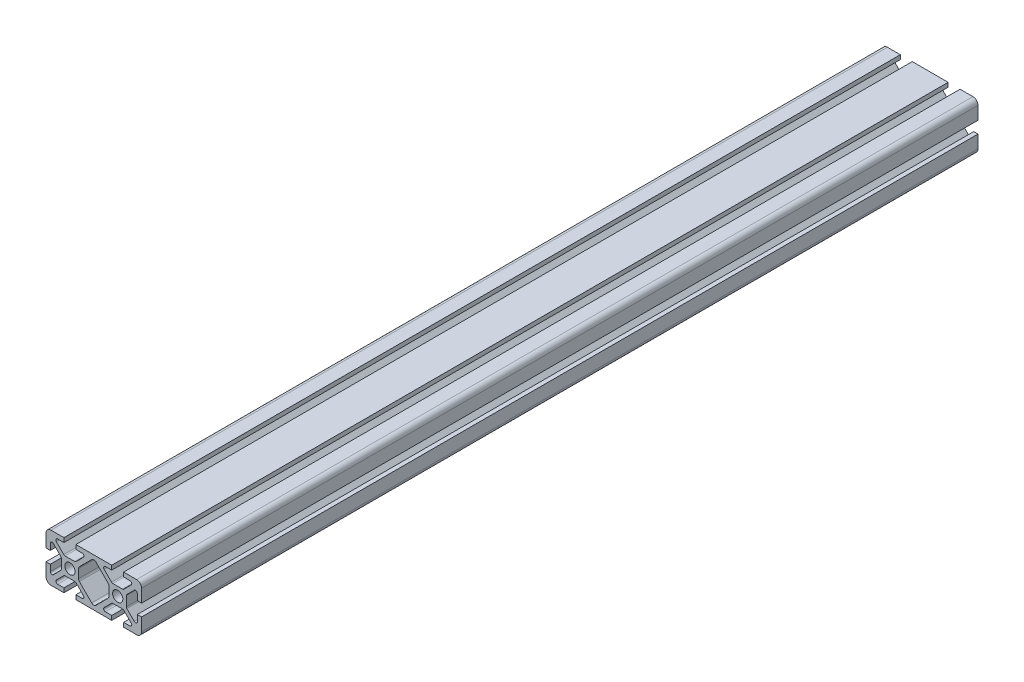
from build123d import *

# Parameters (mm, degrees)
BOSS_EXTRUDE1_DEPTH = 175
BOSS_EXTRUDE2_DEPTH = 175
FILLET1_R           = 0.75
FILLET2_R           = 1.25


with BuildPart() as part:
    # Sketch3 → Boss-Extrude1 (new, symmetric)
    with BuildSketch(Plane.XY):
        with BuildLine():
            Line((12.5, -10), (17.9, -10))
            ThreePointArc((17.9, -10), (19.38492424, -9.38492424), (20, -7.9))
            Line((20, -7.9), (20, -2.5))
            Line((20, -2.5), (18.213351365, -2.5))
            Line((18.213351365, -2.5), (18.213351365, -6.95))
            Line((18.213351365, -6.95), (13.6, -2.336648635))
            Line((13.6, -2.336648635), (13.6, 0))
            Line((13.6, 0), (12.15, 0))
            ThreePointArc((12.15, 0), (11.52027958, -1.52027958), (10, -2.15))
            Line((10, -2.15), (10, -3.6))
            Line((10, -3.6), (12.336648635, -3.6))
            Line((12.336648635, -3.6), (16.95, -8.213351365))
            Line((16.95, -8.213351365), (12.5, -8.213351365))
            Line((12.5, -8.213351365), (12.5, -10))
        make_face()
    extrude(amount=BOSS_EXTRUDE1_DEPTH, both=True)

    # Sketch4 → Boss-Extrude2 (add, symmetric)
    with BuildSketch(Plane.XY):
        with BuildLine():
            Line((10, -3.6), (7.663351365, -3.6))
            Line((7.663351365, -3.6), (3.05, -8.213351365))
            Line((3.05, -8.213351365), (7.5, -8.213351365))
            Line((7.5, -8.213351365), (7.5, -10))
            Line((7.5, -10), (0, -10))
            Line((0, -10), (0, -8.736648635))
            Line((0, -8.736648635), (6.4, -2.336648635))
            Line((6.4, -2.336648635), (6.4, 0))
            Line((6.4, 0), (7.85, 0))
            ThreePointArc((7.85, 0), (8.47972042, -1.52027958), (10, -2.15))
            Line((10, -2.15), (10, -3.6))
        make_face()
    extrude(amount=BOSS_EXTRUDE2_DEPTH, both=True)

    # Mirror1: part across plane


with BuildPart() as part_1:
    add(part.part)
    add(part.part.mirror(Plane(origin=(0, 0, 0), x_dir=(0, 0, 1), z_dir=(1, 0, 0))))

    # Mirror2: part across plane


with BuildPart() as part_2:
    add(part_1.part)
    add(part_1.part.mirror(Plane.ZX))

    # Fillet1
    fillet1_edges = [part_2.edges().sort_by_distance(p)[0] for p in [
        (18.213351365, 6.95, 0),
        (13.6, 2.336648635, 0),
        (12.336648635, 3.6, 0),
        (16.95, 8.213351365, 0),
        (3.05, 8.213351365, 0),
        (7.663351365, 3.6, 0),
        (-18.213351365, 6.95, 0),
        (-13.6, 2.336648635, 0),
        (-7.663351365, 3.6, 0),
        (-12.336648635, 3.6, 0),
        (-16.95, 8.213351365, 0),
        (-3.05, 8.213351365, 0),
        (16.95, -8.213351365, 0),
        (12.336648635, -3.6, 0),
        (13.6, -2.336648635, 0),
        (18.213351365, -6.95, 0),
        (3.05, -8.213351365, 0),
        (7.663351365, -3.6, 0),
        (-18.213351365, -6.95, 0),
        (-13.6, -2.336648635, 0),
        (-12.336648635, -3.6, 0),
        (-16.95, -8.213351365, 0),
        (-3.05, -8.213351365, 0),
        (-7.663351365, -3.6, 0),
    ]]
    fillet(fillet1_edges, radius=FILLET1_R)

    # Fillet2
    fillet2_edges = [part_2.edges().sort_by_distance(p)[0] for p in [
        (6.4, 2.336648635, 0),
        (0, 8.736648635, 0),
        (-6.4, 2.336648635, 0),
        (6.4, -2.336648635, 0),
        (-6.4, -2.336648635, 0),
        (0, -8.736648635, 0),
    ]]
    fillet(fillet2_edges, radius=FILLET2_R)


solid = part_2.part
